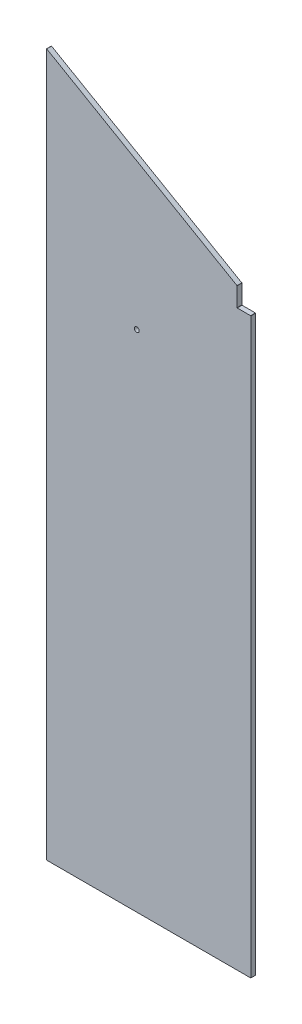
from build123d import *

# Parameters (mm, degrees)
BOSS_EXTRUDE1_DEPTH = 6.35
FILLET2_R           = 0.254
SKETCH2_R           = 3.175
CUT_EXTRUDE1_DEPTH  = 968.053696438


with BuildPart() as part:
    # Sketch1 → Boss-Extrude1 (new body)
    with BuildSketch(Plane.XY):
        Polygon((270.002, 0), (270.002, 757.893717478), (251.956545956, 757.893717478), (251.956545956, 783.293717478), (0, 928.76089711), (0, 0), align=None)
    extrude(amount=BOSS_EXTRUDE1_DEPTH)

    # Fillet2
    fillet2_edges = [part.edges().sort_by_distance(p)[0] for p in [
        (0, 0, 3.175),
        (0, 928.76089711, 3.175),
        (251.956545956, 783.293717478, 3.175),
        (251.956545956, 757.893717478, 3.175),
        (270.002, 757.893717478, 3.175),
    ]]
    fillet(fillet2_edges, radius=FILLET2_R)

    # Sketch2 → Cut-Extrude1 (cut, through all)
    with BuildSketch(Plane.XY.offset(6.35)):
        with Locations((119.38, 666.75)):
            Circle(SKETCH2_R)
    extrude(amount=-CUT_EXTRUDE1_DEPTH, mode=Mode.SUBTRACT)


solid = part.part
